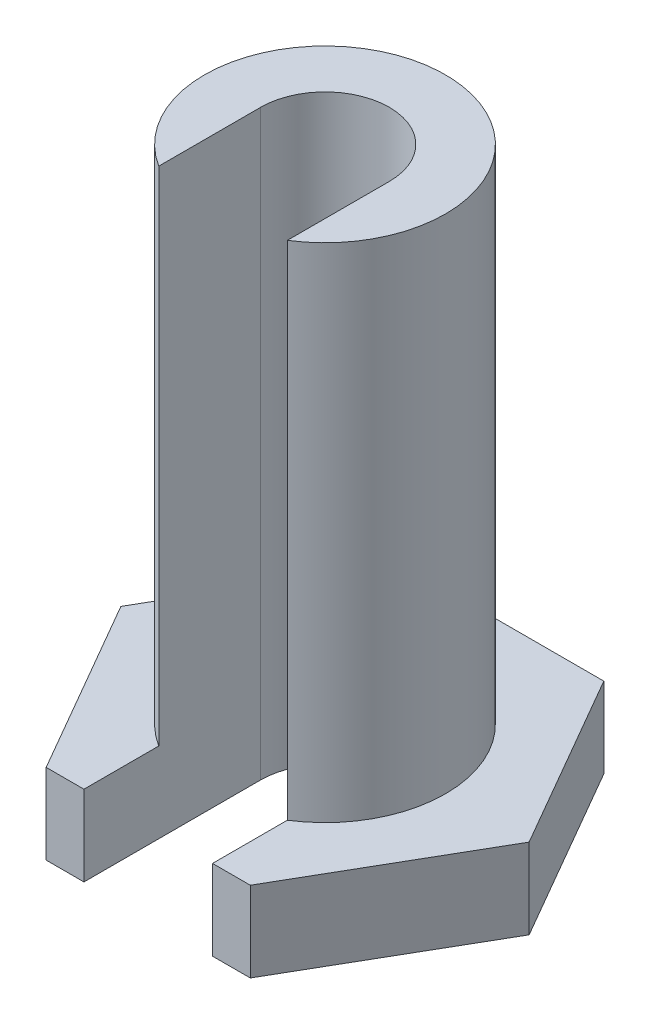
from build123d import *

# Parameters (mm, degrees)
SKETCH1_R               = 3
BOSS_EXTRUDE1_DEPTH     = 14.5
BOSS_EXTRUDE2_DEPTH     = 2
CUT_EXTRUDE1_DEPTH      = 16.981969007
CUT_EXTRUDE1_DEPTH_BACK = 16.981969007


with BuildPart() as part:
    # Sketch1 → Boss-Extrude1 (new body)
    with BuildSketch(Plane(origin=(0, 0, 0), x_dir=(1, 0, 0), z_dir=(0, 1, 0))):
        with Locations(Location((0, 0, 0), (0, 0, 90))):
            Circle(SKETCH1_R)
    extrude(amount=BOSS_EXTRUDE1_DEPTH)

    # Sketch3 → Boss-Extrude2 (add)
    with BuildSketch(Plane(origin=(0, 0, 0), x_dir=(-1, 0, 0), z_dir=(0, -1, 0))):
        Polygon((5.080682369, 0), (2.540341184, 4.4), (-2.540341184, 4.4), (-5.080682369, 0), (-2.540341184, -4.4), (2.540341184, -4.4), align=None)
    extrude(amount=-BOSS_EXTRUDE2_DEPTH)

    # Sketch4 → Cut-Extrude1 (cut, two sides: drawn at the far end of the back side and taken through both)
    with BuildSketch(Plane(origin=(0, 14.5, 0), x_dir=(1, 0, 0), z_dir=(0, 1, 0)).offset(-CUT_EXTRUDE1_DEPTH_BACK)):
        with BuildLine():
            Line((-1.6, 0), (-1.6, -4.4))
            Line((-1.6, -4.4), (1.6, -4.4))
            Line((1.6, -4.4), (1.6, 0))
            ThreePointArc((1.6, 0), (0, 1.6), (-1.6, 0))
        make_face()
    extrude(amount=CUT_EXTRUDE1_DEPTH + CUT_EXTRUDE1_DEPTH_BACK, mode=Mode.SUBTRACT)


solid = part.part
